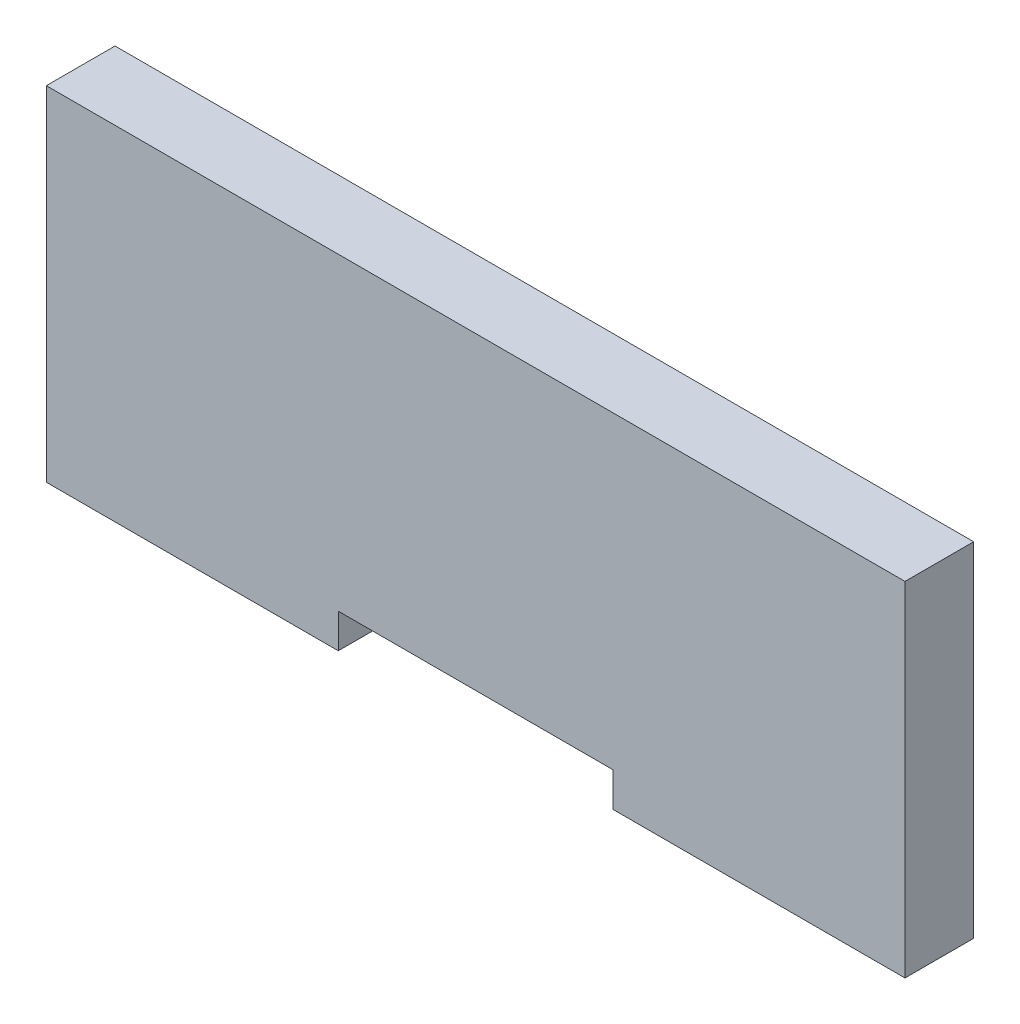
from build123d import *

# Parameters (mm, degrees)
BOSS_EXTRUDE1_DEPTH = 20


with BuildPart() as part:
    # Sketch1 → Boss-Extrude1 (new body)
    with BuildSketch(Plane.XY):
        Polygon((-40, -50), (-125, -50), (-125, 50), (125, 50), (125, -50), (40, -50), (40, -40), (-40, -40), align=None)
    extrude(amount=BOSS_EXTRUDE1_DEPTH)


solid = part.part
